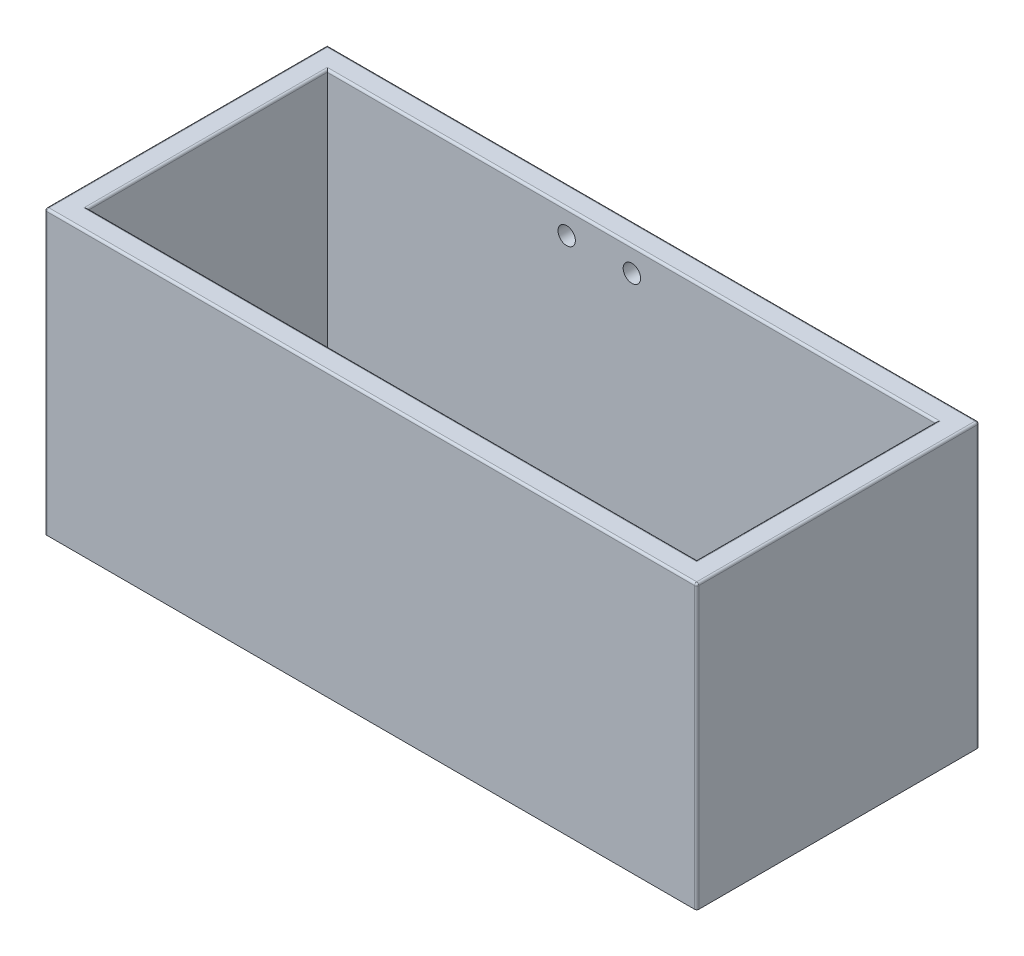
from build123d import *

# Parameters (mm, degrees)
ESQUISSE1_W             = 300
ESQUISSE1_H             = 130
BOSS_EXTRU_2_DEPTH      = 130
ESQUISSE6_W             = 280
ESQUISSE6_H             = 110
ENL_V_MAT_EXTRU_1_DEPTH = 120
CONG_2_R                = 1
CONG_3_R                = 1
CONG_4_R                = 1
CONG_5_R                = 1
CONG_6_R                = 1
CONG_7_R                = 1
ESQUISSE7_R             = 4
ENL_V_MAT_EXTRU_2_DEPTH = 257.497602135


with BuildPart() as part:
    # Esquisse1 → Boss.-Extru.2 (new body)
    with BuildSketch(Plane.XY):
        with Locations((35.717581023, 65)):
            Rectangle(ESQUISSE1_W, ESQUISSE1_H)
    extrude(amount=BOSS_EXTRU_2_DEPTH)

    # Esquisse6 → Enlèv. mat.-Extru.1 (cut)
    with BuildSketch(Plane(origin=(0, 130, 0), x_dir=(1, 0, 0), z_dir=(0, 1, 0))):
        with Locations((35.717581023, -65)):
            Rectangle(ESQUISSE6_W, ESQUISSE6_H)
    extrude(amount=-ENL_V_MAT_EXTRU_1_DEPTH, mode=Mode.SUBTRACT)

    # Congé2
    cong_2_edges = [part.edges().sort_by_distance(p)[0] for p in [
        (-104.282418977, 130, 65),
        (35.717581023, 130, 10),
    ]]
    fillet(cong_2_edges, radius=CONG_2_R)

    # Congé3
    cong_3_edges = [part.edges().sort_by_distance(p)[0] for p in [
        (35.217581023, 130, 120),
    ]]
    fillet(cong_3_edges, radius=CONG_3_R)

    # Congé4
    cong_4_edges = [part.edges().sort_by_distance(p)[0] for p in [
        (175.717581023, 130, 65),
    ]]
    fillet(cong_4_edges, radius=CONG_4_R)

    # Congé5
    cong_5_edges = [part.edges().sort_by_distance(p)[0] for p in [
        (35.717581023, 130, 0),
        (-114.282418977, 130, 65),
    ]]
    fillet(cong_5_edges, radius=CONG_5_R)

    # Congé6
    cong_6_edges = [part.edges().sort_by_distance(p)[0] for p in [
        (36.217581023, 130, 130),
        (-114.282418977, 64.5, 130),
        (-113.989525758, 129.707106781, 130),
    ]]
    fillet(cong_6_edges, radius=CONG_6_R)

    # Congé7
    cong_7_edges = [part.edges().sort_by_distance(p)[0] for p in [
        (185.717581023, 64.5, 130),
        (185.717581023, 64.5, 0),
        (185.717581023, 129.707106781, 0.292893219),
        (185.717581023, 130, 65),
        (185.717581023, 129.707106781, 129.707106781),
    ]]
    fillet(cong_7_edges, radius=CONG_7_R)

    # Esquisse7 → Enlèv. mat.-Extru.2 (cut, through all)
    with BuildSketch(Plane.XY.offset(10)):
        with Locations((5.872475368, 119)):
            Circle(ESQUISSE7_R)
        with Locations((35.872475344, 119.001199684)):
            Circle(ESQUISSE7_R)
    extrude(amount=-ENL_V_MAT_EXTRU_2_DEPTH, mode=Mode.SUBTRACT)


solid = part.part
